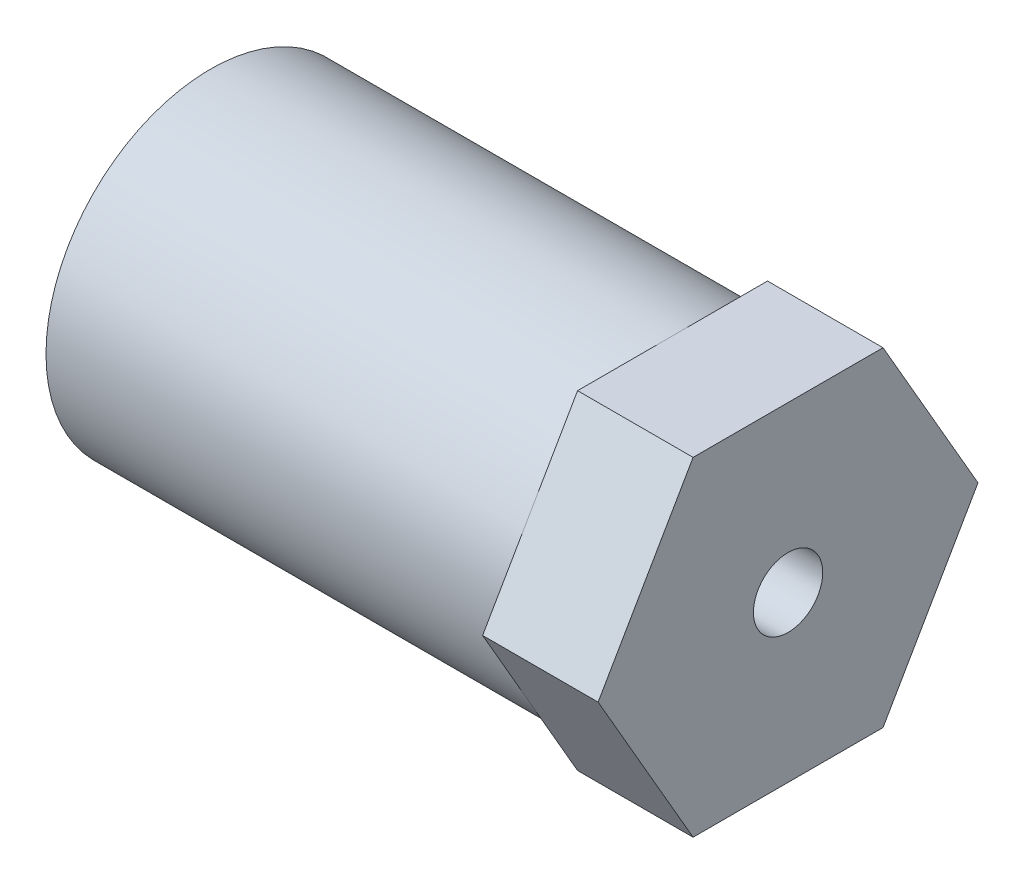
from build123d import *

# Parameters (mm, degrees)
SKETCH_1_W               = 20
SKETCH_1_H               = 7.12
SKETCH_1_4_W             = 12
SKETCH_1_4_H             = 3
EXTRUDE_1_DEPTH          = 5
CUT_EXTRUDE_1_DEPTH      = 28.263289114
CUT_EXTRUDE_1_DEPTH_BACK = 28.263289114
SKETCH_3_R               = 1.5


with BuildPart() as part:
    # 草图1 → 旋转1 (revolve)
    with BuildSketch(Plane.XY):
        with Locations((10, 3.56)):
            Rectangle(SKETCH_1_W, SKETCH_1_H)
    revolve(axis=Axis((-15.976954312, 0, 0), (1, 0, 0)))

    # 草图1<4> → 切除-旋转1 (revolve, cut)
    with BuildSketch(Plane.XY):
        with Locations((6, 1.5)):
            Rectangle(SKETCH_1_4_W, SKETCH_1_4_H)
    revolve(axis=Axis((-15.976954312, 0, 0), (1, 0, 0)), mode=Mode.SUBTRACT)

    # 草图2 → 凸台-拉伸1 (add)
    with BuildSketch(Plane(origin=(20, 0, 0), x_dir=(0, 0, -1), z_dir=(1, 0, 0))):
        Polygon((8.221467833, 0), (4.110733917, 7.12), (-4.110733917, 7.12), (-8.221467833, 0), (-4.110733917, -7.12), (4.110733917, -7.12), align=None)
    extrude(amount=EXTRUDE_1_DEPTH)

    # 草图3 → 切除-拉伸1 (cut, two sides: drawn at the far end of the back side and taken through both)
    with BuildSketch(Plane(origin=(25, 0, 0), x_dir=(0, 0, -1), z_dir=(1, 0, 0)).offset(-CUT_EXTRUDE_1_DEPTH_BACK)):
        Circle(SKETCH_3_R)
    extrude(amount=CUT_EXTRUDE_1_DEPTH + CUT_EXTRUDE_1_DEPTH_BACK, mode=Mode.SUBTRACT)


solid = part.part
